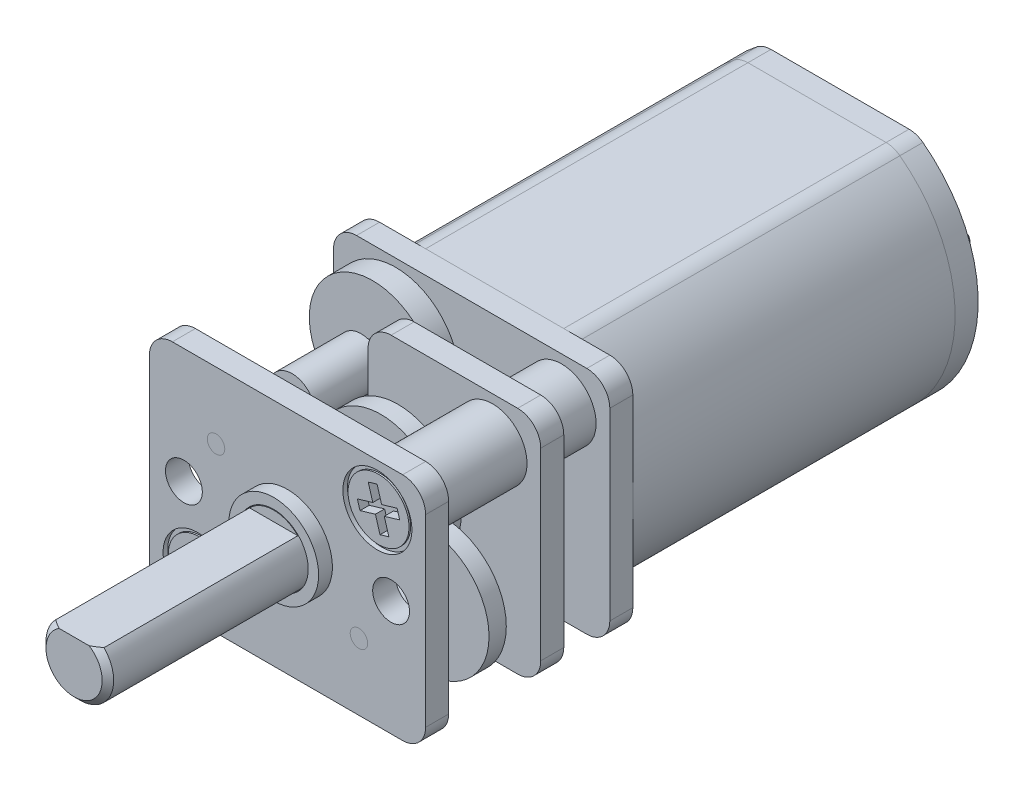
from build123d import *

# Parameters (mm, degrees)
BOSS_EXTRUDE1_DEPTH    = 7.5
FILLET3_R              = 1
BOSS_EXTRUDE2_DEPTH    = 1
BOSS_EXTRUDE3_START    = 9
BOSS_EXTRUDE3_DEPTH    = 1
SKETCH7_R              = 0.5
BOSS_EXTRUDE5_DEPTH    = 8
BOSS_EXTRUDE5_2_DEPTH  = 8
BOSS_EXTRUDE8_START    = 2
BOSS_EXTRUDE8_DEPTH    = 1
CUT_EXTRUDE1_START     = -9
SKETCH5_R              = 0.75
SKETCH5_R_2            = 0.38
CUT_EXTRUDE1_DEPTH     = 9
SKETCH8_R              = 0.5
SKETCH8_R_2            = 0.38
CUT_EXTRUDE2_DEPTH     = 1
BOSS_EXTRUDE6_START    = 0.2
SKETCH9_R              = 2.75
SKETCH9_R_2            = 0.5
BOSS_EXTRUDE6_DEPTH    = 1
BOSS_EXTRUDE16_START   = 0.1
SKETCH9_3_R            = 1
SKETCH9_3_R_2          = 0.75
BOSS_EXTRUDE16_DEPTH   = 1.3
SKETCH6_R              = 1.95
SKETCH6_R_2            = 0.75
BOSS_EXTRUDE4_DEPTH    = 0.6
BOSS_EXTRUDE7_START    = 0.5
SKETCH10_R             = 1
SKETCH10_R_2           = 0.5
BOSS_EXTRUDE7_DEPTH    = 3
SKETCH12_R             = 1.5
SKETCH12_R_2           = 0.75
BOSS_EXTRUDE9_DEPTH    = 2
BOSS_EXTRUDE9_2_DEPTH  = 2
BOSS_EXTRUDE10_START   = 3
SKETCH12_2_R           = 1.5
SKETCH12_2_R_2         = 0.75
BOSS_EXTRUDE10_DEPTH   = 4
BOSS_EXTRUDE10_2_DEPTH = 4
SKETCH13_R             = 1.5
CUT_EXTRUDE3_DEPTH     = 7.2
SKETCH14_R             = 1.5
CUT_EXTRUDE4_DEPTH     = 0.2
CHAMFER1_SIZE          = 0.5
BOSS_EXTRUDE11_START   = 0.2
SKETCH15_R             = 2.75
BOSS_EXTRUDE11_DEPTH   = 0.75
BOSS_EXTRUDE12_START   = 0.2
SKETCH16_R             = 1
BOSS_EXTRUDE12_DEPTH   = 1.15
BOSS_EXTRUDE13_START   = 0.4
SKETCH17_R             = 2.75
BOSS_EXTRUDE13_DEPTH   = 0.75
BOSS_EXTRUDE14_START   = 0.2
SKETCH18_R             = 1
BOSS_EXTRUDE14_DEPTH   = 1.5
SKETCH19_R             = 0.5
CUT_EXTRUDE5_DEPTH     = 25.100622399
SKETCH20_R             = 2.75
BOSS_EXTRUDE15_DEPTH   = 1
CUT_EXTRUDE6_START     = -22.8
SKETCH21_R             = 0.5
CUT_EXTRUDE6_DEPTH     = 24.6
CHAMFER2_SIZE          = 0.25
CUT_EXTRUDE7_DEPTH     = 8.67
SKETCH24_R             = 0.8
CUT_EXTRUDE8_DEPTH     = 1
CUT_EXTRUDE9_START     = -1
CUT_EXTRUDE9_DEPTH     = 1
BOSS_EXTRUDE17_DEPTH   = 1
SKETCH27_R             = 2.5
BOSS_EXTRUDE18_DEPTH   = 1.5
SKETCH28_W             = 0.3
SKETCH28_H             = 1.5
BOSS_EXTRUDE19_DEPTH   = 2
BOSS_EXTRUDE19_2_DEPTH = 2
FILLET1_R              = 0.7
FILLET2_R              = 0.7
CUT_EXTRUDE10_DEPTH    = 0.4


with BuildPart() as part:
    # Sketch1 → Boss-Extrude1 (new, symmetric)
    with BuildSketch(Plane.XY):
        with BuildLine():
            Line((3.31662479, 5), (-3.31662479, 5))
            ThreePointArc((-3.31662479, 5), (-6, 0), (-3.31662479, -5))
            Line((-3.31662479, -5), (3.31662479, -5))
            ThreePointArc((3.31662479, -5), (6, 0), (3.31662479, 5))
        make_face()
    extrude(amount=BOSS_EXTRUDE1_DEPTH, both=True)

    # Fillet3
    fillet3_edges = [part.edges().sort_by_distance(p)[0] for p in [
        (3.31662479, -5, 0),
        (-3.31662479, -5, 0),
        (-3.31662479, 5, 0),
        (3.31662479, 5, 0),
    ]]
    fillet(fillet3_edges, radius=FILLET3_R)

    # Sketch25 → Cut-Extrude9 (cut)
    with BuildSketch(Plane(origin=(0, 0, -7.5), x_dir=(-1, 0, 0), z_dir=(0, 0, -1)).offset(CUT_EXTRUDE9_START)):
        with BuildLine():
            Line((-3, -5), (3, -5))
            ThreePointArc((3, -5), (3.316227766, -4.948683298), (3.6, -4.8))
            ThreePointArc((3.6, -4.8), (6, 0), (3.6, 4.8))
            ThreePointArc((3.6, 4.8), (3.316227766, 4.948683298), (3, 5))
            Line((3, 5), (-3, 5))
            ThreePointArc((-3, 5), (-3.316227766, 4.948683298), (-3.6, 4.8))
            ThreePointArc((-3.6, 4.8), (-6, 0), (-3.6, -4.8))
            ThreePointArc((-3.6, -4.8), (-3.316227766, -4.948683298), (-3, -5))
        make_face()
    extrude(amount=CUT_EXTRUDE9_DEPTH, mode=Mode.SUBTRACT)


with BuildPart() as body_2:
    # Sketch2 → Boss-Extrude2 (new body)
    with BuildSketch(Plane.XY.offset(7.5)):
        with BuildLine():
            Line((-5, -5), (5, -5))
            ThreePointArc((5, -5), (5.707106781, -4.707106781), (6, -4))
            Line((6, -4), (6, 4))
            ThreePointArc((6, 4), (5.707106781, 4.707106781), (5, 5))
            Line((5, 5), (-5, 5))
            ThreePointArc((-5, 5), (-5.707106781, 4.707106781), (-6, 4))
            Line((-6, 4), (-6, -4))
            ThreePointArc((-6, -4), (-5.707106781, -4.707106781), (-5, -5))
        make_face()
    extrude(amount=BOSS_EXTRUDE2_DEPTH)


with BuildPart() as body_3:
    # Sketch2<2> → Boss-Extrude3 (new body)
    with BuildSketch(Plane.XY.offset(7.5).offset(BOSS_EXTRUDE3_START)):
        with BuildLine():
            Line((-5, -5), (5, -5))
            ThreePointArc((5, -5), (5.707106781, -4.707106781), (6, -4))
            Line((6, -4), (6, 4))
            ThreePointArc((6, 4), (5.707106781, 4.707106781), (5, 5))
            Line((5, 5), (-5, 5))
            ThreePointArc((-5, 5), (-5.707106781, 4.707106781), (-6, 4))
            Line((-6, 4), (-6, -4))
            ThreePointArc((-6, -4), (-5.707106781, -4.707106781), (-5, -5))
        make_face()
    extrude(amount=-BOSS_EXTRUDE3_DEPTH)


with BuildPart() as body_4:
    # Sketch7 → Boss-Extrude5 (new body)
    with BuildSketch(Plane.XY.offset(8.5)):
        with Locations(Location((-3.104083332, 2.104083332, 0), (0, 0, 180))):
            Circle(SKETCH7_R)
    extrude(amount=BOSS_EXTRUDE5_DEPTH)


with BuildPart() as body_5:
    # Sketch7 → Boss-Extrude5 2 (new body)
    with BuildSketch(Plane.XY.offset(8.5)):
        with Locations(Location((3.104083332, -2.104083332, 0), (0, 0, 180))):
            Circle(SKETCH7_R)
    extrude(amount=BOSS_EXTRUDE5_2_DEPTH)


with BuildPart() as body_6:
    # Sketch11 → Boss-Extrude8 (new body)
    with BuildSketch(Plane.XY.offset(8.5).offset(BOSS_EXTRUDE8_START)):
        with BuildLine():
            Line((-5, -1.25), (-2.5, -1.25))
            ThreePointArc((-2.5, -1.25), (-1.792893219, -0.957106781), (-1.5, -0.25))
            Line((-1.5, -0.25), (-1.5, 4))
            ThreePointArc((-1.5, 4), (-1.207106781, 4.707106781), (-0.5, 5))
            Line((-0.5, 5), (5, 5))
            ThreePointArc((5, 5), (5.707106781, 4.707106781), (6, 4))
            Line((6, 4), (6, -4))
            ThreePointArc((6, -4), (5.707106781, -4.707106781), (5, -5))
            Line((5, -5), (-5, -5))
            ThreePointArc((-5, -5), (-5.707106781, -4.707106781), (-6, -4))
            Line((-6, -4), (-6, -2.25))
            ThreePointArc((-6, -2.25), (-5.707106781, -1.542893219), (-5, -1.25))
        make_face()
    extrude(amount=BOSS_EXTRUDE8_DEPTH)


with BuildPart() as cut_extrude1_tool:
    # Sketch5 → Cut-Extrude1 (new body)
    with BuildSketch(Plane.XY.offset(16.5).offset(CUT_EXTRUDE1_START)):
        Circle(SKETCH5_R)
        with Locations((-3.104083332, 2.104083332)):
            Circle(SKETCH5_R_2)
        with Locations((3.104083332, -2.104083332)):
            Circle(SKETCH5_R_2)
        with Locations((3.904344047, 3.123475238)):
            Circle(SKETCH5_R)
        with Locations((-3.904344047, -3.123475238)):
            Circle(SKETCH5_R)
    extrude(amount=CUT_EXTRUDE1_DEPTH)


with BuildPart() as body_2_1:
    add(body_2.part)

    # Cut-Extrude1: cut by cut_extrude1_tool
    add(cut_extrude1_tool.part, mode=Mode.SUBTRACT)


with BuildPart() as body_3_1:
    add(body_3.part)

    # Cut-Extrude1: cut by cut_extrude1_tool
    add(cut_extrude1_tool.part, mode=Mode.SUBTRACT)

    # Sketch6 → Boss-Extrude4 (add)
    with BuildSketch(Plane.XY.offset(16.5)):
        with Locations(Location((0, 0, 0), (0, 0, 180))):
            Circle(SKETCH6_R)
        Circle(SKETCH6_R_2, mode=Mode.SUBTRACT)
    extrude(amount=BOSS_EXTRUDE4_DEPTH)

    # Sketch13 → Cut-Extrude3 (cut)
    with BuildSketch(Plane.XY.offset(17.1)):
        Circle(SKETCH13_R)
    extrude(amount=-CUT_EXTRUDE3_DEPTH, mode=Mode.SUBTRACT)

    # Sketch14 → Cut-Extrude4 (cut)
    with BuildSketch(Plane.XY.offset(16.5)):
        with Locations(Location((3.904344047, 3.123475238, 0), (0, 0, 180))):
            Circle(SKETCH14_R)
        with Locations(Location((-3.904344047, -3.123475238, 0), (0, 0, 180))):
            Circle(SKETCH14_R)
    extrude(amount=-CUT_EXTRUDE4_DEPTH, mode=Mode.SUBTRACT)

    # Chamfer1
    chamfer1_edges = [body_3_1.edges().sort_by_distance(p)[0] for p in [
        (3.154344047, 3.123475238, 16.3),
        (-4.654344047, -3.123475238, 16.3),
    ]]
    chamfer(chamfer1_edges, length=CHAMFER1_SIZE)

    # Sketch24 → Cut-Extrude8 (cut)
    with BuildSketch(Plane.XY.offset(16.5)):
        with Locations((4.5, 0)):
            Circle(SKETCH24_R)
        with Locations((-4.5, 0)):
            Circle(SKETCH24_R)
    extrude(amount=-CUT_EXTRUDE8_DEPTH, mode=Mode.SUBTRACT)


with BuildPart() as body_6_1:
    add(body_6.part)

    # Cut-Extrude1: cut by cut_extrude1_tool
    add(cut_extrude1_tool.part, mode=Mode.SUBTRACT)


with BuildPart() as cut_extrude2_tool:
    # Sketch8 → Cut-Extrude2 (new body)
    # profile 1 of 2: a face of its own
    with BuildSketch(Plane.XY.offset(16.5)):
        with Locations((-3.104083332, 2.104083332)):
            Circle(SKETCH8_R)
        with Locations((-3.104083332, 2.104083332)):
            Circle(SKETCH8_R_2, mode=Mode.SUBTRACT)
    # profile 2 of 2: a face of its own
    with BuildSketch(Plane.XY.offset(16.5)):
        with Locations((3.104083332, -2.104083332)):
            Circle(SKETCH8_R)
        with Locations((3.104083332, -2.104083332)):
            Circle(SKETCH8_R_2, mode=Mode.SUBTRACT)
    extrude(amount=-CUT_EXTRUDE2_DEPTH)


with BuildPart() as body_4_1:
    add(body_4.part)

    # Cut-Extrude2: cut by cut_extrude2_tool
    add(cut_extrude2_tool.part, mode=Mode.SUBTRACT)


with BuildPart() as body_5_1:
    add(body_5.part)

    # Cut-Extrude2: cut by cut_extrude2_tool
    add(cut_extrude2_tool.part, mode=Mode.SUBTRACT)


with BuildPart() as body_7:
    # Sketch9 → Boss-Extrude6 (new body)
    with BuildSketch(Plane.XY.offset(8.5).offset(BOSS_EXTRUDE6_START)):
        with Locations((-3.104083332, 2.104083332)):
            Circle(SKETCH9_R)
        with Locations((-3.104083332, 2.104083332)):
            Circle(SKETCH9_R_2, mode=Mode.SUBTRACT)
    extrude(amount=BOSS_EXTRUDE6_DEPTH)


with BuildPart() as body_8:
    # Sketch9<3> → Boss-Extrude16 (new body)
    # profile 1 of 2: a face of its own
    with BuildSketch(Plane.XY.offset(8.5).offset(BOSS_EXTRUDE16_START)):
        Circle(SKETCH9_3_R)
        Circle(SKETCH9_3_R_2, mode=Mode.SUBTRACT)
    # profile 2 of 2: a face of its own
    with BuildSketch(Plane.XY.offset(8.5).offset(BOSS_EXTRUDE16_START)):
        Circle(SKETCH9_3_R_2)
    extrude(amount=BOSS_EXTRUDE16_DEPTH)


with BuildPart() as body_9:
    # Sketch10 → Boss-Extrude7 (new body)
    with BuildSketch(Plane.XY.offset(9.7).offset(BOSS_EXTRUDE7_START)):
        with Locations((-3.104083332, 2.104083332)):
            Circle(SKETCH10_R)
        with Locations((-3.104083332, 2.104083332)):
            Circle(SKETCH10_R_2, mode=Mode.SUBTRACT)
    extrude(amount=BOSS_EXTRUDE7_DEPTH)


with BuildPart() as body_10:
    # Sketch12 → Boss-Extrude9 (new body)
    with BuildSketch(Plane.XY.offset(8.5)):
        with Locations((-3.904344047, -3.123475238)):
            Circle(SKETCH12_R)
        with Locations((-3.904344047, -3.123475238)):
            Circle(SKETCH12_R_2, mode=Mode.SUBTRACT)
    extrude(amount=BOSS_EXTRUDE9_DEPTH)


with BuildPart() as body_11:
    # Sketch12 → Boss-Extrude9 2 (new body)
    with BuildSketch(Plane.XY.offset(8.5)):
        with Locations((3.904344047, 3.123475238)):
            Circle(SKETCH12_R)
        with Locations((3.904344047, 3.123475238)):
            Circle(SKETCH12_R_2, mode=Mode.SUBTRACT)
    extrude(amount=BOSS_EXTRUDE9_2_DEPTH)


with BuildPart() as body_12:
    # Sketch12<2> → Boss-Extrude10 (new body)
    with BuildSketch(Plane.XY.offset(8.5).offset(BOSS_EXTRUDE10_START)):
        with Locations(Location((-3.904344047, -3.123475238, 0), (0, 0, 180))):
            Circle(SKETCH12_2_R)
        with Locations(Location((-3.904344047, -3.123475238, 0), (0, 0, 180))):
            Circle(SKETCH12_2_R_2, mode=Mode.SUBTRACT)
    extrude(amount=BOSS_EXTRUDE10_DEPTH)


with BuildPart() as body_13:
    # Sketch12<2> → Boss-Extrude10 2 (new body)
    with BuildSketch(Plane.XY.offset(8.5).offset(BOSS_EXTRUDE10_START)):
        with Locations(Location((3.904344047, 3.123475238, 0), (0, 0, 180))):
            Circle(SKETCH12_2_R)
        with Locations(Location((3.904344047, 3.123475238, 0), (0, 0, 180))):
            Circle(SKETCH12_2_R_2, mode=Mode.SUBTRACT)
    extrude(amount=BOSS_EXTRUDE10_2_DEPTH)


with BuildPart() as body_14:
    # Sketch15 → Boss-Extrude11 (new body)
    with BuildSketch(Plane.XY.offset(11.5).offset(BOSS_EXTRUDE11_START)):
        Circle(SKETCH15_R)
    extrude(amount=BOSS_EXTRUDE11_DEPTH)


with BuildPart() as body_15:
    # Sketch16 → Boss-Extrude12 (new body)
    with BuildSketch(Plane.XY.offset(12.45).offset(BOSS_EXTRUDE12_START)):
        Circle(SKETCH16_R)
    extrude(amount=BOSS_EXTRUDE12_DEPTH)


with BuildPart() as body_16:
    # Sketch17 → Boss-Extrude13 (new body)
    with BuildSketch(Plane.XY.offset(12.45).offset(BOSS_EXTRUDE13_START)):
        with Locations((3.104083332, -2.104083332)):
            Circle(SKETCH17_R)
    extrude(amount=BOSS_EXTRUDE13_DEPTH)


with BuildPart() as body_17:
    # Sketch18 → Boss-Extrude14 (new body)
    with BuildSketch(Plane.XY.offset(13.6).offset(BOSS_EXTRUDE14_START)):
        with Locations((3.104083332, -2.104083332)):
            Circle(SKETCH18_R)
    extrude(amount=BOSS_EXTRUDE14_DEPTH)


with BuildPart() as cut_extrude5_tool:
    # Sketch19 → Cut-Extrude5 (new, through all)
    with BuildSketch(Plane.XY.offset(15.3)):
        with Locations((3.104083332, -2.104083332)):
            Circle(SKETCH19_R)
    extrude(amount=-CUT_EXTRUDE5_DEPTH)


with BuildPart() as body_17_1:
    add(body_17.part)

    # Cut-Extrude5: cut by cut_extrude5_tool
    add(cut_extrude5_tool.part, mode=Mode.SUBTRACT)


with BuildPart() as body_16_1:
    add(body_16.part)

    # Cut-Extrude5: cut by cut_extrude5_tool
    add(cut_extrude5_tool.part, mode=Mode.SUBTRACT)


with BuildPart() as body_6_2:
    add(body_6_1.part)

    # Cut-Extrude5: cut by cut_extrude5_tool
    add(cut_extrude5_tool.part, mode=Mode.SUBTRACT)


with BuildPart() as body_18:
    # Sketch20 → Boss-Extrude15 (new body)
    with BuildSketch(Plane.XY.offset(15.3)):
        Circle(SKETCH20_R)
    extrude(amount=-BOSS_EXTRUDE15_DEPTH)


with BuildPart() as cut_extrude6_tool:
    # Sketch21 → Cut-Extrude6 (new body)
    with BuildSketch(Plane.XY.offset(15.3).offset(CUT_EXTRUDE6_START)):
        Circle(SKETCH21_R)
    extrude(amount=CUT_EXTRUDE6_DEPTH)


with BuildPart() as body_14_1:
    add(body_14.part)

    # Cut-Extrude6: cut by cut_extrude6_tool
    add(cut_extrude6_tool.part, mode=Mode.SUBTRACT)


with BuildPart() as body_15_1:
    add(body_15.part)

    # Cut-Extrude6: cut by cut_extrude6_tool
    add(cut_extrude6_tool.part, mode=Mode.SUBTRACT)


with BuildPart() as body_18_1:
    add(body_18.part)

    # Cut-Extrude6: cut by cut_extrude6_tool
    add(cut_extrude6_tool.part, mode=Mode.SUBTRACT)


with BuildPart() as body_8_1:
    add(body_8.part)

    # Cut-Extrude6: cut by cut_extrude6_tool
    add(cut_extrude6_tool.part, mode=Mode.SUBTRACT)


with BuildPart() as body_19:
    # Sketch22 → Revolve1 (revolve)
    with BuildSketch(Plane(origin=(0, 0, 0), x_dir=(1, 0, 0), z_dir=(0, 1, 0))):
        Polygon((-0.5, -7.5), (-0.5, -15.3), (-1.47, -15.3), (-1.47, -25.77), (0, -25.77), (0, -7.5), align=None)
    revolve(axis=Axis((0, 0, 0), (0, 0, 1)))

    # Chamfer2
    chamfer2_edges = [body_19.edges().sort_by_distance(p)[0] for p in [
        (1.47, 0, 25.77),
    ]]
    chamfer(chamfer2_edges, length=CHAMFER2_SIZE)

    # Sketch23 → Cut-Extrude7 (cut)
    with BuildSketch(Plane.XY.offset(25.77)):
        with BuildLine():
            Line((1.048808848, 1.03), (-1.048808848, 1.03))
            ThreePointArc((-1.048808848, 1.03), (0, 1.47), (1.048808848, 1.03))
        make_face()
    extrude(amount=-CUT_EXTRUDE7_DEPTH, mode=Mode.SUBTRACT)


with BuildPart() as body_20:
    # Sketch26 → Boss-Extrude17 (new body)
    with BuildSketch(Plane(origin=(0, 0, -6.5), x_dir=(-1, 0, 0), z_dir=(0, 0, -1))):
        with BuildLine():
            Line((-3, -5), (3, -5))
            ThreePointArc((3, -5), (3.316227766, -4.948683298), (3.6, -4.8))
            ThreePointArc((3.6, -4.8), (6, 0), (3.6, 4.8))
            ThreePointArc((3.6, 4.8), (3.316227766, 4.948683298), (3, 5))
            Line((3, 5), (-3, 5))
            ThreePointArc((-3, 5), (-3.316227766, 4.948683298), (-3.6, 4.8))
            ThreePointArc((-3.6, 4.8), (-6, 0), (-3.6, -4.8))
            ThreePointArc((-3.6, -4.8), (-3.316227766, -4.948683298), (-3, -5))
        make_face()
    extrude(amount=BOSS_EXTRUDE17_DEPTH)

    # Sketch27 → Boss-Extrude18 (add)
    with BuildSketch(Plane(origin=(0, 0, -7.5), x_dir=(-1, 0, 0), z_dir=(0, 0, -1))):
        Circle(SKETCH27_R)
    extrude(amount=BOSS_EXTRUDE18_DEPTH)


with BuildPart() as body_21:
    # Sketch28 → Boss-Extrude19 (new body)
    with BuildSketch(Plane(origin=(0, 0, -7.5), x_dir=(-1, 0, 0), z_dir=(0, 0, -1))):
        with Locations((3.5, 0)):
            Rectangle(SKETCH28_W, SKETCH28_H)
    extrude(amount=BOSS_EXTRUDE19_DEPTH)

    # Fillet1
    fillet1_edges = [body_21.edges().sort_by_distance(p)[0] for p in [
        (-3.5, -0.75, -9.5),
        (-3.5, 0.75, -9.5),
    ]]
    fillet(fillet1_edges, radius=FILLET1_R)


with BuildPart() as body_22:
    # Sketch28 → Boss-Extrude19 2 (new body)
    with BuildSketch(Plane(origin=(0, 0, -7.5), x_dir=(-1, 0, 0), z_dir=(0, 0, -1))):
        with Locations((-3.5, 0)):
            Rectangle(SKETCH28_W, SKETCH28_H)
    extrude(amount=BOSS_EXTRUDE19_2_DEPTH)

    # Fillet2
    fillet2_edges = [body_22.edges().sort_by_distance(p)[0] for p in [
        (3.5, -0.75, -9.5),
        (3.5, 0.75, -9.5),
    ]]
    fillet(fillet2_edges, radius=FILLET2_R)


with BuildPart() as body_23:
    # Sketch29 → Revolve2 (revolve)
    with BuildSketch(Plane(origin=(0, 0, 0), x_dir=(0.7808688094430303, 0.6246950475544244, 0), z_dir=(0.6246950475544244, -0.7808688094430304, 0)), mode=Mode.PRIVATE) as revolve2_sk:
        Polygon((5.7, 7.5), (5.7, 15.755), (6.325, 16.38), (6.325, 16.45), (5, 16.45), (5, 7.5), align=None)
    revolve(revolve2_sk.sketch.rotate(Axis((3.904344047, 3.123475238, 16.5), (0, 0, 1)), 141.340191746), axis=Axis((3.904344047, 3.123475238, 16.5), (0, 0, 1)))


with BuildPart() as body_24:
    # Sketch29<3> → Revolve3 (revolve)
    with BuildSketch(Plane(origin=(0, 0, 0), x_dir=(0.7808688094430303, 0.6246950475544244, 0), z_dir=(0.6246950475544244, -0.7808688094430304, 0)), mode=Mode.PRIVATE) as revolve3_sk:
        Polygon((-5.7, 7.5), (-5.7, 15.755), (-6.325, 16.38), (-6.325, 16.45), (-5, 16.45), (-5, 7.5), align=None)
    revolve(revolve3_sk.sketch.rotate(Axis((-3.904344047, -3.123475238, 16.5), (0, 0, 1)), 321.340191746), axis=Axis((-3.904344047, -3.123475238, 16.5), (0, 0, 1)))


with BuildPart() as cut_extrude10_tool:
    # Sketch30 → Cut-Extrude10 (new body)
    with BuildSketch(Plane.XY.offset(16.45)):
        Polygon((-3.774222132, -2.210749492), (-4.020996733, -2.865808494), (-4.676055735, -2.619033892), (-4.817069793, -2.993353322), (-4.162010791, -3.240127924), (-4.408785393, -3.895186926), (-4.034465963, -4.036200984), (-3.787691361, -3.381141982), (-3.132632359, -3.627916583), (-2.991618301, -3.253597153), (-3.646677303, -3.006822552), (-3.399902702, -2.35176355), align=None)
        Polygon((3.456494168, 3.929347737), (3.65569802, 3.258290493), (2.984640775, 3.059086641), (3.098471548, 2.675625358), (3.769528792, 2.87482921), (3.968732644, 2.203771966), (4.352193927, 2.317602738), (4.152990075, 2.988659983), (4.824047319, 3.187863835), (4.710216547, 3.571325117), (4.039159302, 3.372121265), (3.83995545, 4.04317851), align=None)
    extrude(amount=-CUT_EXTRUDE10_DEPTH)


with BuildPart() as body_23_1:
    add(body_23.part)

    # Cut-Extrude10: cut by cut_extrude10_tool
    add(cut_extrude10_tool.part, mode=Mode.SUBTRACT)


with BuildPart() as body_24_1:
    add(body_24.part)

    # Cut-Extrude10: cut by cut_extrude10_tool
    add(cut_extrude10_tool.part, mode=Mode.SUBTRACT)


solid = Compound([part.part, body_2_1.part, body_3_1.part, body_4_1.part, body_5_1.part, body_7.part, body_9.part, body_10.part, body_11.part, body_12.part, body_13.part, body_17_1.part, body_16_1.part, body_6_2.part, body_14_1.part, body_15_1.part, body_18_1.part, body_8_1.part, body_19.part, body_20.part, body_21.part, body_22.part, body_23_1.part, body_24_1.part])
